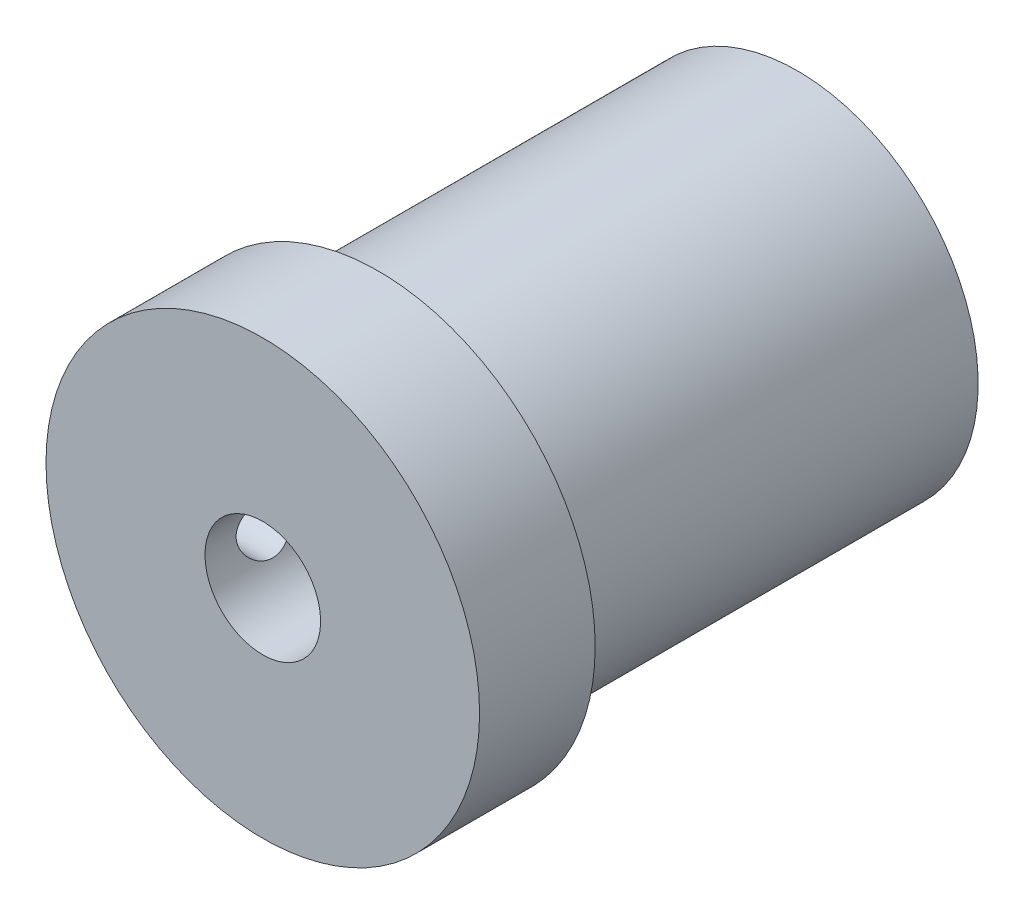
from build123d import *

# Parameters (mm, degrees)
SKETCH1_R                  = 12.5
SKETCH1_R_2                = 4
BOSS_EXTRUDE1_DEPTH        = 29
SKETCH2_R                  = 15
BOSS_EXTRUDE2_DEPTH        = 8
SKETCH3_R                  = 4
CUT_EXTRUDE2_DEPTH         = 43.649736224
F_4_0MM_DOWEL_HOLE1_REACH  = 48.947
F_4_0MM_DOWEL_HOLE1_BORE_R = 2


with BuildPart() as part:
    # Sketch1 → Boss-Extrude1 (new body)
    with BuildSketch(Plane.XY):
        with Locations(Location((0, 0, 0), (0, 0, 180))):
            Circle(SKETCH1_R)
        with Locations(Location((0, 0, 0), (0, 0, 180))):
            Circle(SKETCH1_R_2, mode=Mode.SUBTRACT)
    extrude(amount=BOSS_EXTRUDE1_DEPTH)

    # Sketch2 → Boss-Extrude2 (add)
    with BuildSketch(Plane.XY.offset(29)):
        Circle(SKETCH2_R)
    extrude(amount=BOSS_EXTRUDE2_DEPTH)

    # Sketch3 → Cut-Extrude2 (cut, through all)
    with BuildSketch(Plane(origin=(0, 0, 0), x_dir=(-1, 0, 0), z_dir=(0, 0, -1))):
        Circle(SKETCH3_R)
    extrude(amount=-CUT_EXTRUDE2_DEPTH, mode=Mode.SUBTRACT)

    # Ø4.0mm Dowel Hole1 bore (on position points) → Ø4.0mm Dowel Hole1 (cut, up to next)
    with BuildSketch(Plane(origin=(-14.99999933, 0.004483968, 32.846680342), x_dir=(-0.000298931176, -0.99999995532, 0), z_dir=(-0.99999995532, 0.000298931176, 0)), mode=Mode.PRIVATE) as f_4_0mm_dowel_hole1_sk1:
        Circle(F_4_0MM_DOWEL_HOLE1_BORE_R)
    f_4_0mm_dowel_hole1_tool1 = extrude(f_4_0mm_dowel_hole1_sk1.sketch, amount=-F_4_0MM_DOWEL_HOLE1_REACH, mode=Mode.PRIVATE) & part.part
    add(f_4_0mm_dowel_hole1_tool1.solids().sort_by_distance((-14.999999, 0.004484, 32.84668))[0], mode=Mode.SUBTRACT)


solid = part.part
